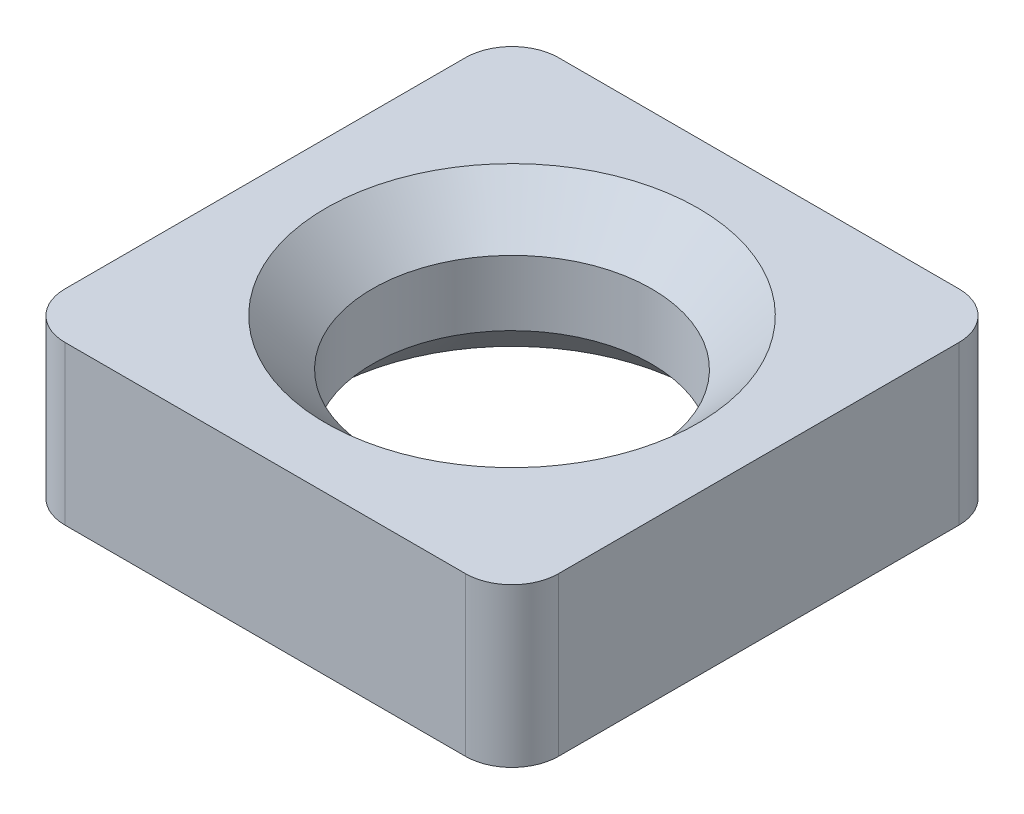
from build123d import *

# Parameters (mm, degrees)
SKETCH1_W           = 5.3
SKETCH1_H           = 5.3
SKETCH1_R           = 1.5
BOSS_EXTRUDE1_DEPTH = 1.7
FILLET1_R           = 0.5
CHAMFER1_SIZE       = 0.5


with BuildPart() as part:
    # Sketch1 → Boss-Extrude1 (new body)
    with BuildSketch(Plane(origin=(0, 0, 0), x_dir=(1, 0, 0), z_dir=(0, 1, 0))):
        Rectangle(SKETCH1_W, SKETCH1_H)
        with Locations(Location((0, 0, 0), (0, 0, 270))):
            Circle(SKETCH1_R, mode=Mode.SUBTRACT)
    extrude(amount=BOSS_EXTRUDE1_DEPTH)

    # Fillet1
    fillet1_edges = [part.edges().sort_by_distance(p)[0] for p in [
        (2.65, 0.85, 2.65),
        (-2.65, 0.85, 2.65),
        (-2.65, 0.85, -2.65),
        (2.65, 0.85, -2.65),
    ]]
    fillet(fillet1_edges, radius=FILLET1_R)

    # Chamfer1
    chamfer1_edges = [part.edges().sort_by_distance(p)[0] for p in [
        (0, 0, -1.5),
        (0, 1.7, -1.5),
    ]]
    chamfer(chamfer1_edges, length=CHAMFER1_SIZE)


solid = part.part
